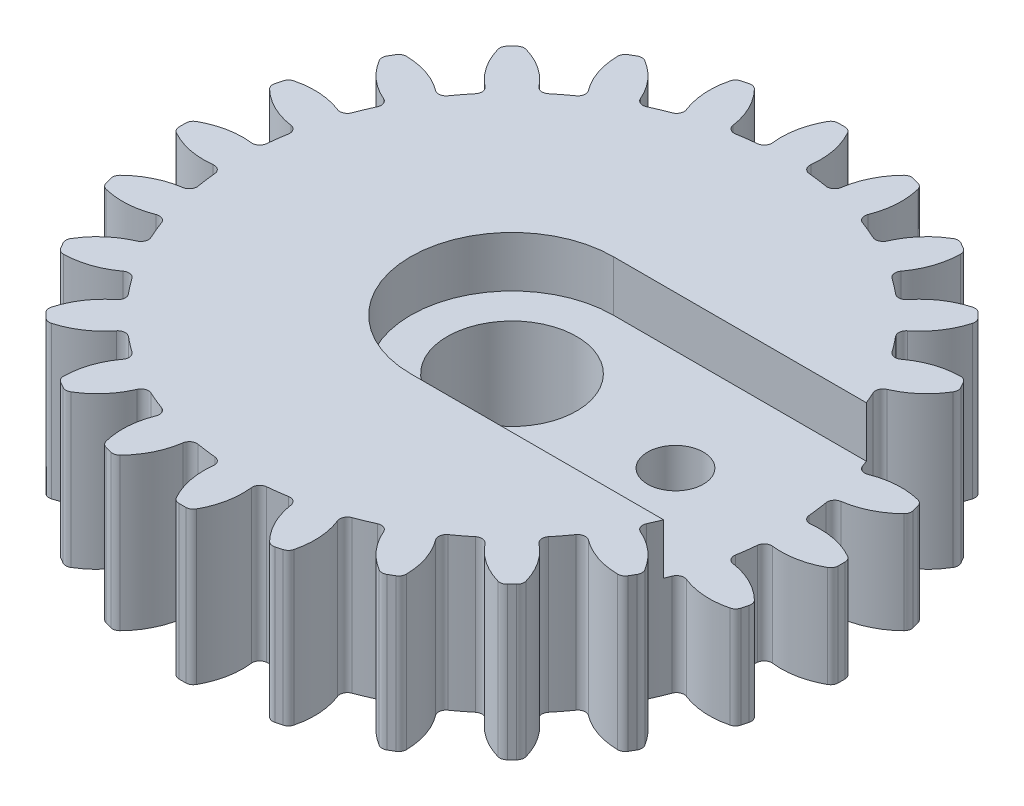
from build123d import *

# Parameters (mm, degrees)
SKETCH2_R           = 10.75
SKETCH2_R_2         = 2.55
BOSS_EXTRUDE1_DEPTH = 6
BOSS_EXTRUDE2_DEPTH = 6
CIRPATTERN2_COUNT   = 24
FILLET1_R           = 0.3
SKETCH3_R           = 1.1
CUT_EXTRUDE1_DEPTH  = 10
CUT_EXTRUDE2_DEPTH  = 2


with BuildPart() as part:
    # Sketch2 → Boss-Extrude1 (new body)
    with BuildSketch(Plane(origin=(0, 0, 0), x_dir=(1, 0, 0), z_dir=(0, 1, 0))):
        with Locations(Location((0, 0, 0), (0, 0, 270))):
            Circle(SKETCH2_R)
        with Locations(Location((0, 0, 0), (0, 0, 270))):
            Circle(SKETCH2_R_2, mode=Mode.SUBTRACT)
    extrude(amount=BOSS_EXTRUDE1_DEPTH)

    # Sketch2<5> → Boss-Extrude2 (add)
    with BuildSketch(Plane(origin=(0, 0, 0), x_dir=(1, 0, 0), z_dir=(0, 1, 0))):
        with BuildLine():
            ThreePointArc((0.7, 10.727185092), (0.727483638, 11.903628123), (0.3, 13))
            Line((0.3, 13), (-0.3, 13))
            ThreePointArc((-0.3, 13), (-0.727483638, 11.903628123), (-0.7, 10.727185092))
            ThreePointArc((-0.7, 10.727185092), (0, 10.75), (0.7, 10.727185092))
        make_face()
    boss_extrude2 = extrude(amount=BOSS_EXTRUDE2_DEPTH)

    # CirPattern2: Boss-Extrude2 ×24 about axis
    cirpattern2_axis = Axis((0, 0, 0), (0, 1, 0))
    for i in range(1, CIRPATTERN2_COUNT):
        add(boss_extrude2.rotate(cirpattern2_axis, i * 360 / CIRPATTERN2_COUNT))

    # Fillet1
    fillet1_edges = [part.edges().sort_by_distance(p)[0] for p in [
        (4.757374763, 3, 9.640014801),
        (6.240192379, 3, 11.408330249),
        (6.759807621, 3, 11.108330249),
        (5.969810329, 3, 8.940014801),
        (2.100251724, 3, 10.542838455),
        (3.074869838, 3, 12.634681455),
        (3.654425334, 3, 12.479390028),
        (3.452547881, 3, 10.180491792),
        (-0.7, 3, 10.727185092),
        (-0.3, 3, 13),
        (0.3, 3, 13),
        (0.7, 3, 10.727185092),
        (0.7, 3, -10.727185092),
        (-3.452547881, 3, 10.180491792),
        (-3.654425334, 3, 12.479390028),
        (-3.074869838, 3, 12.634681455),
        (-2.100251724, 3, 10.542838455),
        (0.3, 3, -13),
        (-0.3, 3, -13),
        (-5.969810329, 3, 8.940014801),
        (-6.759807621, 3, 11.108330249),
        (-6.240192379, 3, 11.408330249),
        (-4.757374763, 3, 9.640014801),
        (-0.7, 3, -10.727185092),
        (-8.080240068, 3, 7.090290575),
        (-9.40452019, 3, 8.980256121),
        (-8.980256121, 3, 9.40452019),
        (-7.090290575, 3, 8.080240068),
        (-9.640014801, 3, 4.757374763),
        (-11.408330249, 3, 6.240192379),
        (-11.108330249, 3, 6.759807621),
        (-8.940014801, 3, 5.969810329),
        (-10.542838455, 3, 2.100251724),
        (-12.634681455, 3, 3.074869838),
        (-12.479390028, 3, 3.654425334),
        (-10.180491792, 3, 3.452547881),
        (-10.727185092, 3, -0.7),
        (-13, 3, -0.3),
        (-13, 3, 0.3),
        (-10.727185092, 3, 0.7),
        (-10.180491792, 3, -3.452547881),
        (-12.479390028, 3, -3.654425334),
        (-12.634681455, 3, -3.074869838),
        (-10.542838455, 3, -2.100251724),
        (-8.940014801, 3, -5.969810329),
        (-11.108330249, 3, -6.759807621),
        (-11.408330249, 3, -6.240192379),
        (-9.640014801, 3, -4.757374763),
        (-7.090290575, 3, -8.080240068),
        (-8.980256121, 3, -9.40452019),
        (-9.40452019, 3, -8.980256121),
        (-8.080240068, 3, -7.090290575),
        (-4.757374763, 3, -9.640014801),
        (-6.240192379, 3, -11.408330249),
        (-6.759807621, 3, -11.108330249),
        (-5.969810329, 3, -8.940014801),
        (10.727185092, 3, 0.7),
        (13, 3, 0.3),
        (13, 3, -0.3),
        (10.727185092, 3, -0.7),
        (10.542838455, 3, -2.100251724),
        (12.634681455, 3, -3.074869838),
        (12.479390028, 3, -3.654425334),
        (10.180491792, 3, -3.452547881),
        (9.640014801, 3, -4.757374763),
        (11.408330249, 3, -6.240192379),
        (11.108330249, 3, -6.759807621),
        (8.940014801, 3, -5.969810329),
        (8.080240068, 3, -7.090290575),
        (9.40452019, 3, -8.980256121),
        (8.980256121, 3, -9.40452019),
        (7.090290575, 3, -8.080240068),
        (5.969810329, 3, -8.940014801),
        (6.759807621, 3, -11.108330249),
        (6.240192379, 3, -11.408330249),
        (4.757374763, 3, -9.640014801),
        (3.452547881, 3, -10.180491792),
        (3.654425334, 3, -12.479390028),
        (3.074869838, 3, -12.634681455),
        (2.100251724, 3, -10.542838455),
        (-2.100251724, 3, -10.542838455),
        (-3.074869838, 3, -12.634681455),
        (-3.654425334, 3, -12.479390028),
        (-3.452547881, 3, -10.180491792),
        (10.180491792, 3, 3.452547881),
        (12.479390028, 3, 3.654425334),
        (12.634681455, 3, 3.074869838),
        (10.542838455, 3, 2.100251724),
        (8.940014801, 3, 5.969810329),
        (11.108330249, 3, 6.759807621),
        (11.408330249, 3, 6.240192379),
        (9.640014801, 3, 4.757374763),
        (7.090290575, 3, 8.080240068),
        (8.980256121, 3, 9.40452019),
        (9.40452019, 3, 8.980256121),
        (8.080240068, 3, 7.090290575),
    ]]
    fillet(fillet1_edges, radius=FILLET1_R)

    # Sketch3 → Cut-Extrude1 (cut)
    with BuildSketch(Plane(origin=(0, 6, 0), x_dir=(1, 0, 0), z_dir=(0, 1, 0))):
        with Locations(Location((6.45, 0, 0), (0, 0, 270))):
            Circle(SKETCH3_R)
    extrude(amount=-CUT_EXTRUDE1_DEPTH, mode=Mode.SUBTRACT)

    # Sketch4 → Cut-Extrude2 (cut)
    with BuildSketch(Plane(origin=(0, 6, 0), x_dir=(1, 0, 0), z_dir=(0, 1, 0))):
        with BuildLine():
            Line((0, 4), (16.248499211, 4))
            Line((16.248499211, 4), (16.248499211, -4))
            Line((16.248499211, -4), (0, -4))
            ThreePointArc((0, -4), (-4, 0), (0, 4))
        make_face()
    extrude(amount=-CUT_EXTRUDE2_DEPTH, mode=Mode.SUBTRACT)


solid = part.part
